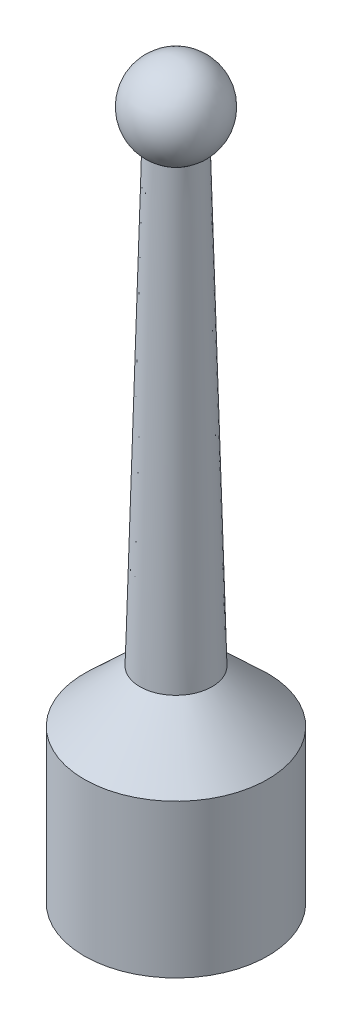
from build123d import *


with BuildPart() as part:
    # Sketch1 → Revolve1 (revolve)
    with BuildSketch(Plane.XY, mode=Mode.PRIVATE) as revolve1_sk:
        with BuildLine():
            Line((0, 0), (7.4295, 0))
            Line((7.4295, 0), (7.4295, 12.3952))
            Line((7.4295, 12.3952), (2.921, 16.637))
            Line((2.921, 16.637), (1.9685, 52.98510252))
            ThreePointArc((1.9685, 52.98510252), (3.323724219, 56.885068512), (0, 59.3344))
            Line((0, 59.3344), (0, 0))
        make_face()
    revolve(revolve1_sk.sketch.rotate(Axis((0, 0, 0), (0, 1, 0)), 90), axis=Axis((0, 0, 0), (0, 1, 0)))


solid = part.part
